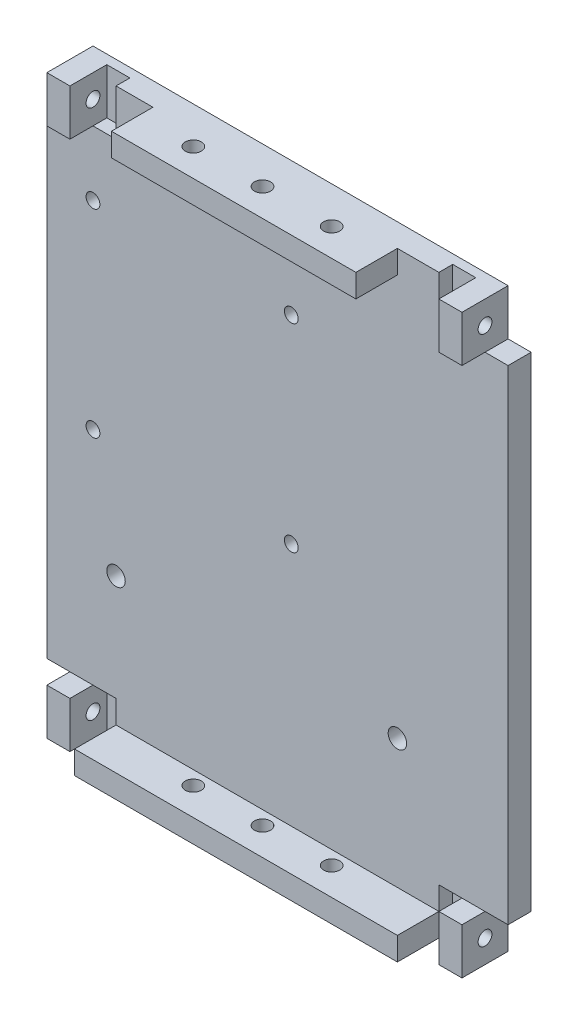
from build123d import *

# Parameters (mm, degrees)
SKETCH1_W           = 90
SKETCH1_H           = 125
BOSS_EXTRUDE1_DEPTH = 5
SKETCH2_W           = 5
SKETCH2_H           = 105
BOSS_EXTRUDE2_DEPTH = 5
SKETCH3_W           = 5
SKETCH3_H           = 10
BOSS_EXTRUDE3_DEPTH = 5
SKETCH4_W           = 5
SKETCH4_H           = 10
CUT_EXTRUDE1_DEPTH  = 3
SKETCH5_R           = 1.5
CUT_EXTRUDE2_DEPTH  = 15
CUT_EXTRUDE3_START  = -15
SKETCH6_R           = 1.5
CUT_EXTRUDE3_DEPTH  = 15
SKETCH7_W           = 53
SKETCH7_H           = 5
SKETCH7_W_2         = 70
BOSS_EXTRUDE4_DEPTH = 9
CUT_EXTRUDE4_REACH  = 162.689
SKETCH8_R           = 1.75
SKETCH9_R           = 1.5
CUT_EXTRUDE5_DEPTH  = 5
SKETCH10_R          = 2
CUT_EXTRUDE6_DEPTH  = 5
SKETCH11_W          = 5
SKETCH11_H          = 105
BOSS_EXTRUDE5_DEPTH = 5


with BuildPart() as part:
    # Sketch1 → Boss-Extrude1 (new body)
    with BuildSketch(Plane.XY):
        with Locations((-50, 62.5)):
            Rectangle(SKETCH1_W, SKETCH1_H)
    extrude(amount=BOSS_EXTRUDE1_DEPTH)

    # Sketch2 → Boss-Extrude2 (add)
    with BuildSketch(Plane.ZY.offset(95)):
        with Locations((2.5, 62.5)):
            Rectangle(SKETCH2_W, SKETCH2_H)
    extrude(amount=BOSS_EXTRUDE2_DEPTH)

    # Sketch3 → Boss-Extrude3 (add)
    with BuildSketch(Plane.XY.offset(5)):
        with Locations((-7.5, 120)):
            Rectangle(SKETCH3_W, SKETCH3_H)
        with Locations((-92.5, 120)):
            Rectangle(SKETCH3_W, SKETCH3_H)
        with Locations((-7.5, 5)):
            Rectangle(SKETCH3_W, SKETCH3_H)
        with Locations((-92.5, 5)):
            Rectangle(SKETCH3_W, SKETCH3_H)
    extrude(amount=BOSS_EXTRUDE3_DEPTH)

    # Sketch4 → Cut-Extrude1 (cut)
    with BuildSketch(Plane.XY.offset(5)):
        with Locations((-87.5, 120)):
            Rectangle(SKETCH4_W, SKETCH4_H)
        with Locations((-12.5, 120)):
            Rectangle(SKETCH4_W, SKETCH4_H)
        with Locations((-12.5, 5)):
            Rectangle(SKETCH4_W, SKETCH4_H)
        with Locations((-87.5, 5)):
            Rectangle(SKETCH4_W, SKETCH4_H)
    extrude(amount=-CUT_EXTRUDE1_DEPTH, mode=Mode.SUBTRACT)

    # Sketch5 → Cut-Extrude2 (cut)
    with BuildSketch(Plane(origin=(0, 0, 0), x_dir=(0, 0, -1), z_dir=(1, 0, 0))):
        with Locations(Location((-5, 5, 0), (0, 0, 90))):
            Circle(SKETCH5_R)
        with Locations(Location((-5, 120, 0), (0, 0, 90))):
            Circle(SKETCH5_R)
    extrude(amount=-CUT_EXTRUDE2_DEPTH, mode=Mode.SUBTRACT)

    # Sketch6 → Cut-Extrude3 (cut)
    with BuildSketch(Plane.ZY.offset(100).offset(CUT_EXTRUDE3_START)):
        with Locations(Location((5, 5, 0), (0, 0, 90))):
            Circle(SKETCH6_R)
        with Locations(Location((5, 120, 0), (0, 0, 90))):
            Circle(SKETCH6_R)
    extrude(amount=CUT_EXTRUDE3_DEPTH, mode=Mode.SUBTRACT)

    # Sketch7 → Boss-Extrude4 (add)
    with BuildSketch(Plane.XY.offset(5)):
        with Locations((-50.5, 122.5)):
            Rectangle(SKETCH7_W, SKETCH7_H)
        with Locations((-50, 2.5)):
            Rectangle(SKETCH7_W_2, SKETCH7_H)
    extrude(amount=BOSS_EXTRUDE4_DEPTH)

    # Cut-Extrude4: up to this face of the body (flat: up to its plane)
    cut_extrude4_end = Plane(part.part.faces().sort_by_distance((-50.251847941, 125, 6.258183738))[0])
    # Sketch8 → Cut-Extrude4 (cut, up to the picked face)
    with BuildSketch(Plane.XZ, mode=Mode.PRIVATE) as cut_extrude4_sk1:
        with Locations(Location((-65.25, 8, 0), (0, 0, 270))):
            Circle(SKETCH8_R)
    cut_extrude4_tool1 = split(extrude(cut_extrude4_sk1.sketch, amount=-CUT_EXTRUDE4_REACH, mode=Mode.PRIVATE), bisect_by=cut_extrude4_end, keep=Keep.BOTH, mode=Mode.PRIVATE)
    # Sketch8 → Cut-Extrude4 (cut, up to the picked face)
    with BuildSketch(Plane.XZ, mode=Mode.PRIVATE) as cut_extrude4_sk2:
        with Locations(Location((-50.25, 8, 0), (0, 0, 270))):
            Circle(SKETCH8_R)
    cut_extrude4_tool2 = split(extrude(cut_extrude4_sk2.sketch, amount=-CUT_EXTRUDE4_REACH, mode=Mode.PRIVATE), bisect_by=cut_extrude4_end, keep=Keep.BOTH, mode=Mode.PRIVATE)
    # Sketch8 → Cut-Extrude4 (cut, up to the picked face)
    with BuildSketch(Plane.XZ, mode=Mode.PRIVATE) as cut_extrude4_sk3:
        with Locations(Location((-35.25, 8, 0), (0, 0, 270))):
            Circle(SKETCH8_R)
    cut_extrude4_tool3 = split(extrude(cut_extrude4_sk3.sketch, amount=-CUT_EXTRUDE4_REACH, mode=Mode.PRIVATE), bisect_by=cut_extrude4_end, keep=Keep.BOTH, mode=Mode.PRIVATE)
    add(cut_extrude4_tool1.solids().sort_by(Axis((-65.25, 0, 8), (0, 1, 0)))[0], mode=Mode.SUBTRACT)
    add(cut_extrude4_tool2.solids().sort_by(Axis((-50.25, 0, 8), (0, 1, 0)))[0], mode=Mode.SUBTRACT)
    add(cut_extrude4_tool3.solids().sort_by(Axis((-35.25, 0, 8), (0, 1, 0)))[0], mode=Mode.SUBTRACT)

    # Sketch9 → Cut-Extrude5 (cut)
    with BuildSketch(Plane.XY.offset(5)):
        with Locations((-47, 101)):
            Circle(SKETCH9_R)
        with Locations((-90, 101)):
            Circle(SKETCH9_R)
        with Locations((-90, 58)):
            Circle(SKETCH9_R)
        with Locations((-47, 58)):
            Circle(SKETCH9_R)
    extrude(amount=-CUT_EXTRUDE5_DEPTH, mode=Mode.SUBTRACT)

    # Sketch10 → Cut-Extrude6 (cut)
    with BuildSketch(Plane.XY.offset(5)):
        with Locations((-85, 33)):
            Circle(SKETCH10_R)
        with Locations((-24, 33)):
            Circle(SKETCH10_R)
    extrude(amount=-CUT_EXTRUDE6_DEPTH, mode=Mode.SUBTRACT)

    # Sketch11 → Boss-Extrude5 (add)
    with BuildSketch(Plane(origin=(-5, 0, 0), x_dir=(0, 0, -1), z_dir=(1, 0, 0))):
        with Locations((-2.5, 62.5)):
            Rectangle(SKETCH11_W, SKETCH11_H)
    extrude(amount=BOSS_EXTRUDE5_DEPTH)


solid = part.part
